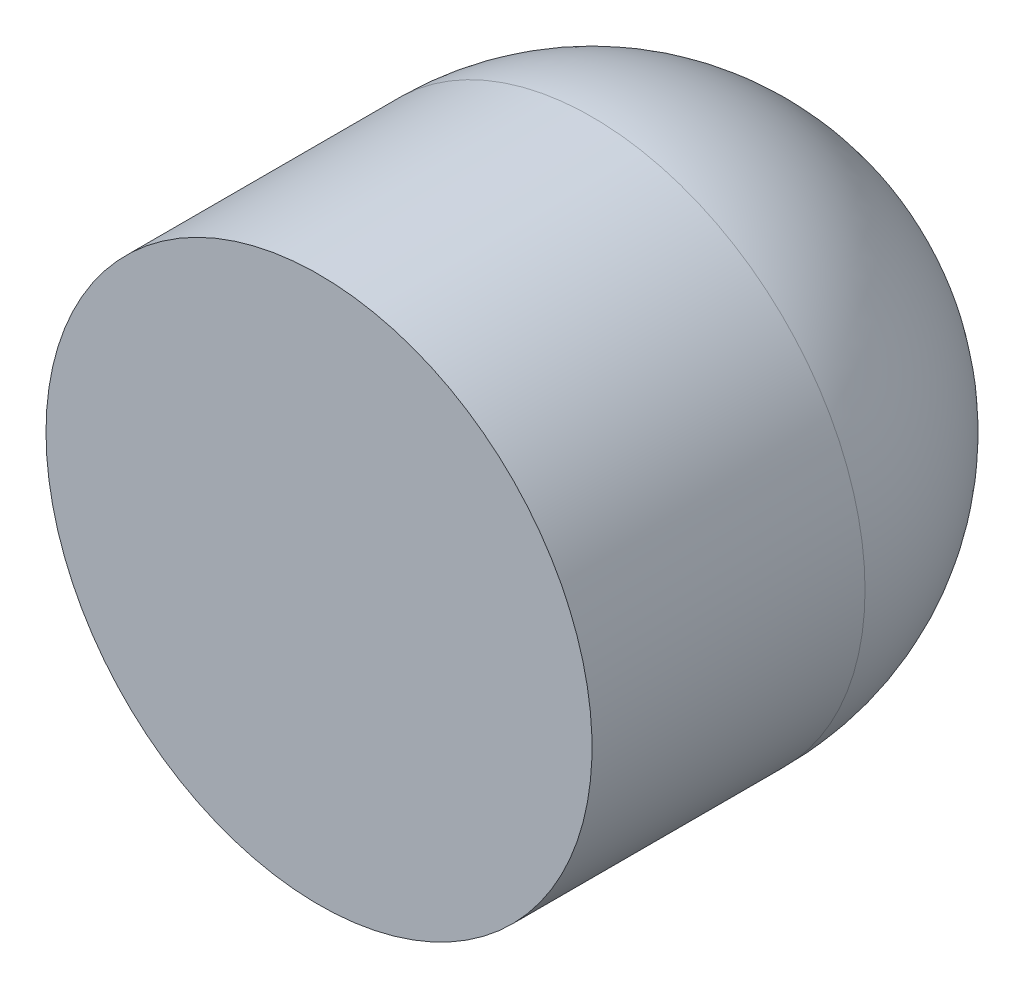
from build123d import *


with BuildPart() as part:
    # Sketch1 → Revolve1 (revolve)
    with BuildSketch(Plane(origin=(0, 0, 0), x_dir=(1, 0, 0), z_dir=(0, 1, 0))):
        with BuildLine():
            Line((0, 0), (0, -20))
            Line((0, -20), (10, -20))
            Line((10, -20), (10, -10))
            ThreePointArc((10, -10), (7.071067812, -2.928932188), (0, 0))
        make_face()
    revolve(axis=Axis((0, 0, 0), (0, 0, 1)))


solid = part.part
